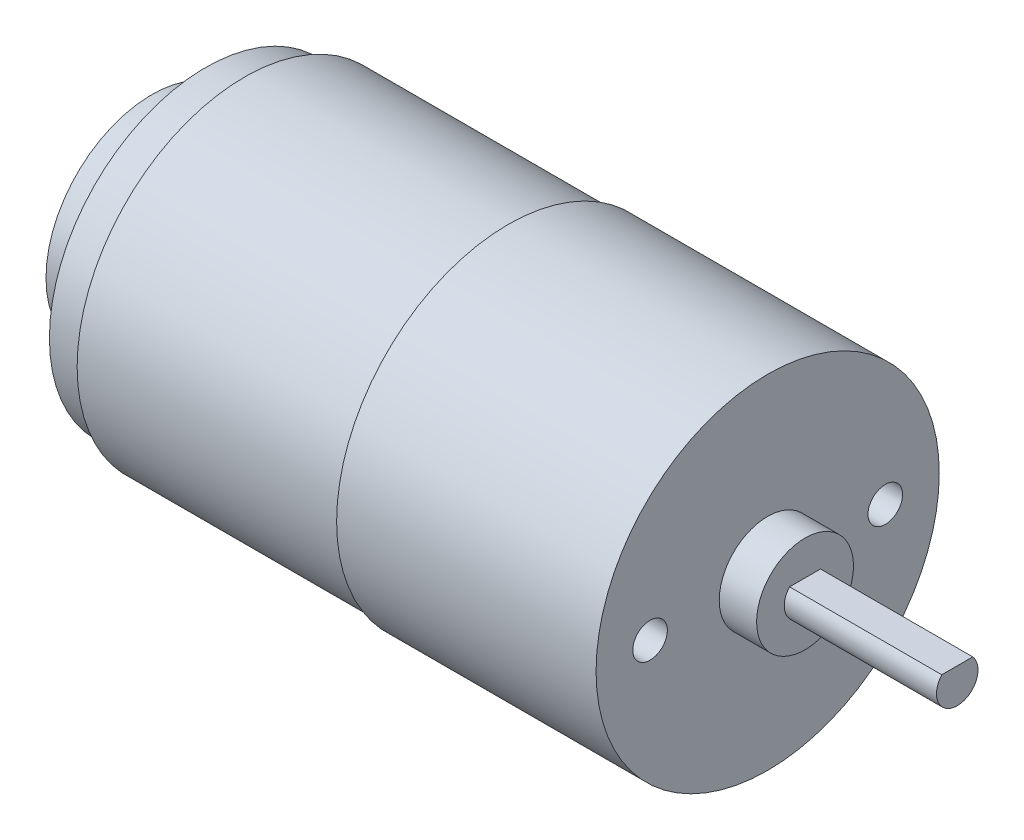
from build123d import *

# Parameters (mm, degrees)
CUT_EXTRUDE_3_DEPTH = 11
SKETCH_3_R          = 1.25
CUT_EXTRUDE_4_DEPTH = 13


with BuildPart() as part:
    # 草图1 → 旋转1 (revolve)
    with BuildSketch(Plane.XY, mode=Mode.PRIVATE) as revolve_1_sk:
        Polygon((-29.173795435, 0), (-29.173795435, 7.650126796), (-25.287235841, 7.650126796), (-25.287235841, 11.290701606), (-22.473795435, 11.290701606), (-22.473795435, 12.1), (-3.423795435, 12.1), (-3.423795435, 12.4), (15.326204565, 12.4), (15.326204565, 3.5), (18.026204565, 3.5), (18.026204565, 1.5), (29.026204565, 1.5), (29.026204565, 0), align=None)
    revolve(revolve_1_sk.sketch.rotate(Axis((-38.029247675, 0, 0), (1, 0, 0)), 90), axis=Axis((-38.029247675, 0, 0), (1, 0, 0)))

    # 草图2 → 切除-拉伸3 (cut)
    with BuildSketch(Plane(origin=(29.026204565, 0, 0), x_dir=(0, 0, -1), z_dir=(1, 0, 0))):
        Polygon((-49.186248705, 1), (-1.118033989, 1), (1.118033989, 1), (49.186248705, 1), (49.186248705, 97.136429433), (-49.186248705, 97.136429433), align=None)
    extrude(amount=-CUT_EXTRUDE_3_DEPTH, mode=Mode.SUBTRACT)

    # 草图3 → 切除-拉伸4 (cut)
    with BuildSketch(Plane(origin=(15.326204565, 0, 0), x_dir=(0, 0, -1), z_dir=(1, 0, 0))):
        with Locations((-8.5, 0)):
            Circle(SKETCH_3_R)
        with Locations(Location((8.5, 0, 0), (0, 0, 180))):
            Circle(SKETCH_3_R)
    extrude(amount=-CUT_EXTRUDE_4_DEPTH, mode=Mode.SUBTRACT)


solid = part.part
